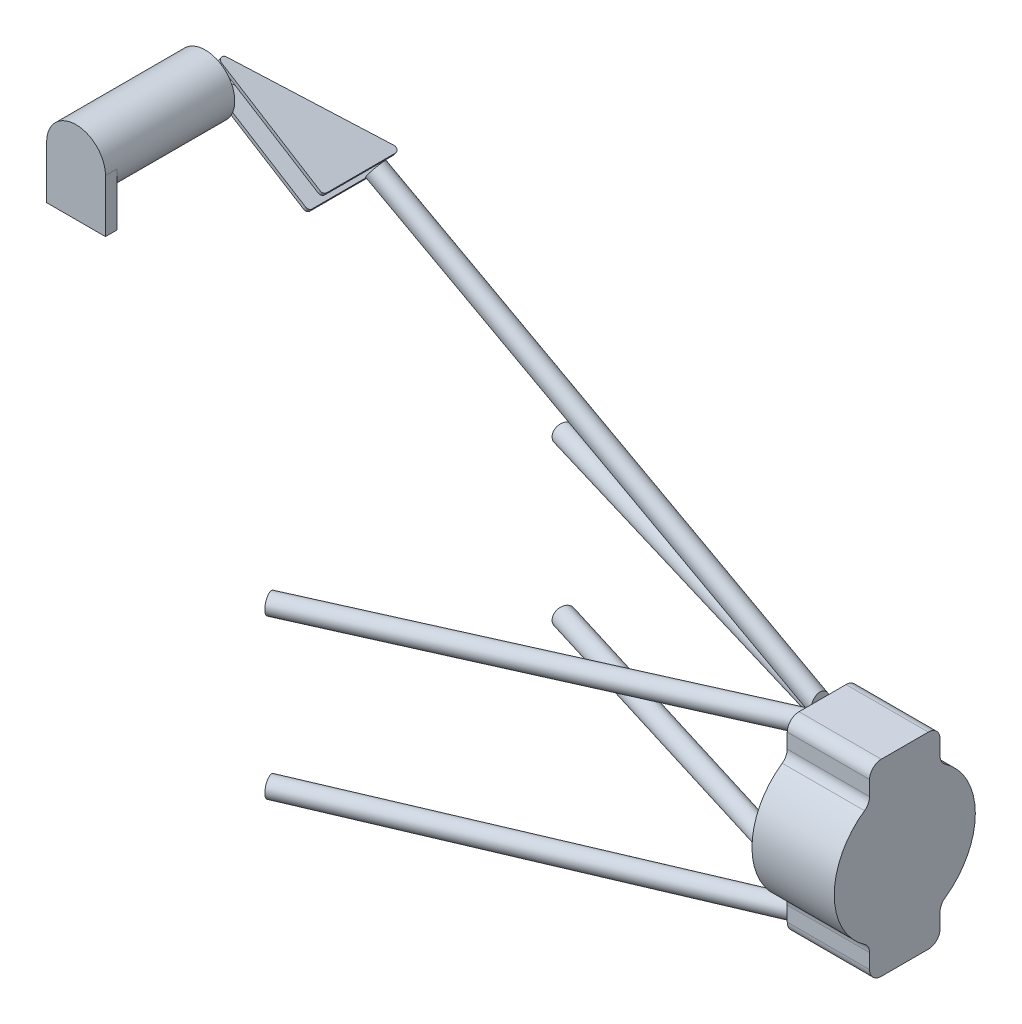
from build123d import *

# Parameters (mm, degrees)
SWEEP1_PROFILE_R    = 8
SWEEP3_PROFILE_R    = 8
SWEEP4_PROFILE_R    = 8
SKETCH32_W          = 65
SKETCH32_H          = 100
CUT_EXTRUDE1_DEPTH  = 250
BOSS_EXTRUDE1_DEPTH = 70
FILLET1_R           = 10
SKETCH46_W          = 50
SKETCH46_H          = 120
BOSS_EXTRUDE2_DEPTH = 70
CUT_EXTRUDE2_DEPTH  = 110
CUT_EXTRUDE3_DEPTH  = 200
SKETCH48_R          = 25
SKETCH48_R_2        = 10
CUT_EXTRUDE4_DEPTH  = 10
BOSS_EXTRUDE3_DEPTH = 12.5
FILLET2_R           = 3
CUT_EXTRUDE6_DEPTH  = 80


with BuildPart() as part:
    # Sweep1: sweep along a curve in space
    with BuildLine() as sweep1_path:
        Line((515, 220, -2140), (170, 210, -2000))
        Line((515, 220, -2140), (170, 210, -2250))
    # Sweep1 profile (on start of the path) → Sweep1 (sweep)
    with BuildSketch(Plane(origin=(170, 210, -2250), x_dir=(-0.303773534632601, 0, 0.9527442677113394), z_dir=(0.9523811791814951, 0.02760525157047804, 0.30365776727525934))):
        Circle(SWEEP1_PROFILE_R)
    sweep(path=sweep1_path.line, transition=Transition.RIGHT)

    # Sweep3: sweep along a curve in space
    with BuildLine() as sweep3_path:
        Line((160, 475, -2100), (515, 220, -2140))
    # Sweep3 profile (on start of the path) → Sweep3 (sweep)
    with BuildSketch(Plane(origin=(160, 475, -2100), x_dir=(0.5834003151932643, 0.8121847525239563, 0), z_dir=(0.8088050353813585, -0.5809726310485813, -0.09113296173311082))):
        Circle(SWEEP3_PROFILE_R)
    sweep(path=sweep3_path.line)


with BuildPart() as body_2:
    # Sweep4: sweep along a curve in space
    with BuildLine() as sweep4_path:
        Line((170, 75, -2000), (515, 80, -2140))
        Line((515, 80, -2140), (170, 75, -2250))
    # Sweep4 profile (on start of the path) → Sweep4 (sweep)
    with BuildSketch(Plane(origin=(170, 75, -2000), x_dir=(0.37601680602465715, 0, 0.9266128434179052), z_dir=(0.9265293008091237, 0.013427960881291534, -0.37598290467616613))):
        Circle(SWEEP4_PROFILE_R)
    sweep(path=sweep4_path.line, transition=Transition.RIGHT)


with BuildPart() as cut_extrude1_tool:
    # Sketch32 → Cut-Extrude1 (new body)
    with BuildSketch(Plane(origin=(0, 0, 0), x_dir=(1, 0, 0), z_dir=(0, 1, 0))):
        with Locations((532.5, 2140)):
            Rectangle(SKETCH32_W, SKETCH32_H)
    extrude(amount=CUT_EXTRUDE1_DEPTH)


with BuildPart() as part_1:
    add(part.part)

    # Cut-Extrude1: cut by cut_extrude1_tool
    add(cut_extrude1_tool.part, mode=Mode.SUBTRACT)



with BuildPart() as body_2_1:
    add(body_2.part)

    # Cut-Extrude1: cut by cut_extrude1_tool
    add(cut_extrude1_tool.part, mode=Mode.SUBTRACT)


with BuildPart() as part_2:
    add(part_1.part)

    add(body_2_1.part)  # Boss-Extrude1 merges body 2
    # Sketch36 → Boss-Extrude1 (add)
    with BuildSketch(Plane(origin=(500, 0, 0), x_dir=(0, 0, -1), z_dir=(1, 0, 0))):
        with BuildLine():
            Line((2170, 235), (2110, 235))
            Line((2110, 235), (2110, 206.961524227))
            ThreePointArc((2110, 206.961524227), (2080, 155), (2110, 103.038475773))
            Line((2110, 103.038475773), (2110, 75))
            Line((2110, 75), (2170, 75))
            Line((2170, 75), (2170, 103.038475773))
            ThreePointArc((2170, 103.038475773), (2200, 155), (2170, 206.961524227))
            Line((2170, 206.961524227), (2170, 235))
        make_face()
    extrude(amount=BOSS_EXTRUDE1_DEPTH)

    # Fillet1
    fillet1_edges = [part_2.edges().sort_by_distance(p)[0] for p in [
        (535, 75, -2110),
        (535, 103.038475773, -2110),
        (535, 75, -2170),
        (535, 103.038475773, -2170),
        (535, 206.961524227, -2170),
        (535, 235, -2170),
        (535, 206.961524227, -2110),
        (535, 235, -2110),
    ]]
    fillet(fillet1_edges, radius=FILLET1_R)


with BuildPart() as body_2_2:
    # Sketch46 → Boss-Extrude2 (new body)
    with BuildSketch(Plane(origin=(0, 485, 0), x_dir=(-1, 0, 0), z_dir=(0, -1, 0))):
        with Locations((-80, 1985)):
            Rectangle(SKETCH46_W, SKETCH46_H)
    extrude(amount=-BOSS_EXTRUDE2_DEPTH)

    # Sketch47 → Cut-Extrude2 (cut)
    with BuildSketch(Plane(origin=(0, 0, -2045), x_dir=(-1, 0, 0), z_dir=(0, 0, -1))):
        with BuildLine():
            Line((-105, 530), (-105, 485))
            Line((-105, 485), (-55, 485))
            Line((-55, 485), (-55, 530))
            ThreePointArc((-55, 530), (-80, 505), (-105, 530))
        make_face()
    extrude(amount=-CUT_EXTRUDE2_DEPTH, mode=Mode.SUBTRACT)

    # Sketch47<3> → Cut-Extrude3 (cut)
    with BuildSketch(Plane(origin=(0, 0, -2045), x_dir=(-1, 0, 0), z_dir=(0, 0, -1))):
        with BuildLine():
            Line((-105, 555), (-105, 530))
            ThreePointArc((-105, 530), (-97.67766953, 547.67766953), (-80, 555))
            Line((-80, 555), (-105, 555))
        make_face()
        with BuildLine():
            ThreePointArc((-80, 555), (-62.32233047, 547.67766953), (-55, 530))
            Line((-55, 530), (-55, 555))
            Line((-55, 555), (-80, 555))
        make_face()
    extrude(amount=-CUT_EXTRUDE3_DEPTH, mode=Mode.SUBTRACT)

    # Sketch48 → Cut-Extrude4 (cut)
    with BuildSketch(Plane(origin=(0, 0, -2045), x_dir=(-1, 0, 0), z_dir=(0, 0, -1))):
        with Locations((-80, 530)):
            Circle(SKETCH48_R)
        with Locations((-80, 530)):
            Circle(SKETCH48_R_2, mode=Mode.SUBTRACT)
    extrude(amount=-CUT_EXTRUDE4_DEPTH, mode=Mode.SUBTRACT)


with BuildPart() as body_3:
    # 3DSketch5 → Boss-Extrude3 (new, symmetric)
    with BuildSketch(Plane(origin=(160, 475, -2100), x_dir=(-0.7384737551630453, 0.5077007066745938, 0.44373021688578856), z_dir=(0.5665288228870654, 0.8240419241993675, 0))):
        Polygon((0, 0), (22.988113551, 46.42694291), (111.406601209, 6.210411185), (125.060567406, 0), (-6.655953253, -13.442406269), align=None)
    extrude(amount=BOSS_EXTRUDE3_DEPTH, both=True)

    # Fillet2
    fillet2_edges = [body_3.edges().sort_by_distance(p)[0] for p in [
        (160, 475, -2048.193490828),
        (160, 475, -2115),
        (67.646053165, 538.493338449, -2044.506847301),
    ]]
    fillet(fillet2_edges, radius=FILLET2_R)

    # Sketch49 → Cut-Extrude6 (cut)
    with BuildSketch(Plane(origin=(677.30948868, -533.727991738, -2742.575646447), x_dir=(0.10110962041936954, -0.919429562579397, -0.3800343722792846), z_dir=(0.4387387824033014, -0.3016329129022692, 0.8464785092779147))):
        Polygon((-1211.606132679, -448.18320438), (-1224.913105521, -434.621328633), (-1319.418451462, -527.350394677), (-1306.111478621, -540.912270424), align=None)
    extrude(amount=CUT_EXTRUDE6_DEPTH, mode=Mode.SUBTRACT)


with BuildPart() as cut_extrude6_piece_1:
    # of the separate pieces the step leaves, piece 1, a body of its own (cut_extrude6_pieces)
    add(body_3.part.solids().sort_by_distance((154.617976183, 467.17160172, -2051.096429587))[0])


with BuildPart() as cut_extrude6_piece_2:
    # of the separate pieces the step leaves, piece 2, a body of its own (cut_extrude6_pieces)
    add(body_3.part.solids().sort_by_distance((167.081610286, 485.300524052, -2109.568948156))[0])


with BuildPart() as part_3:
    # Body-Move/Copy1: moved
    add(part_2.part.moved(Location((0, 46, 0))))


with BuildPart() as cut_extrude6_piece_2_1:
    # Body-Move/Copy1: moved
    add(cut_extrude6_piece_2.part.moved(Location((0, 46, 0))))


with BuildPart() as body_2_2_1:
    # Body-Move/Copy1: moved
    add(body_2_2.part.moved(Location((0, 46, 0))))


with BuildPart() as cut_extrude6_piece_1_1:
    # Body-Move/Copy1: moved
    add(cut_extrude6_piece_1.part.moved(Location((0, 46, 0))))


solid = Compound([part_3.part, cut_extrude6_piece_2_1.part, body_2_2_1.part, cut_extrude6_piece_1_1.part])
